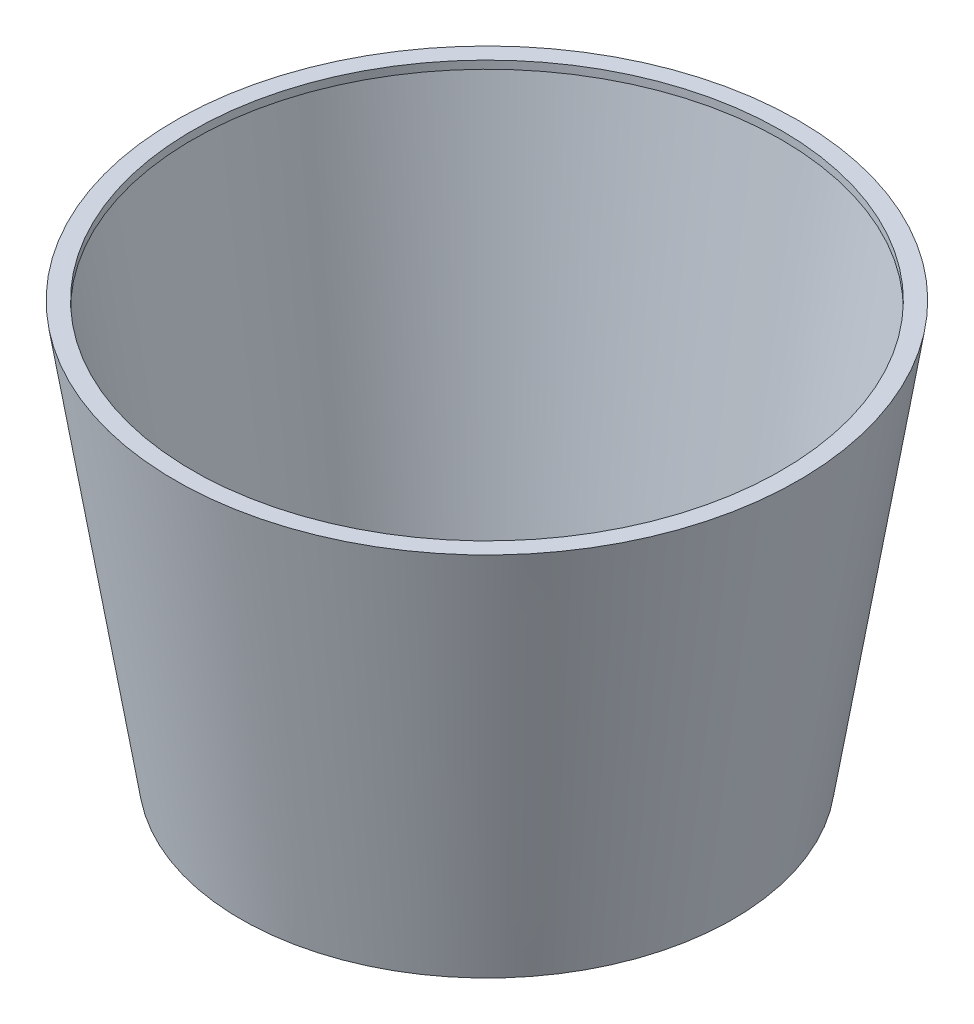
from build123d import *


with BuildPart() as part:
    # Sketch1 → Revolve-Thin3 (revolve)
    with BuildSketch(Plane.XY, mode=Mode.PRIVATE) as revolve_thin3_sk:
        Polygon((0, 0), (30.1625, 0), (38.1, 50), (37.1, 50), (37.1, 51), (39.271272376, 51), (31.016272376, -1), (0, -1), align=None)
    revolve(revolve_thin3_sk.sketch.rotate(Axis((0, 0, 0), (0, 1, 0)), 90), axis=Axis((0, 0, 0), (0, 1, 0)))


solid = part.part
